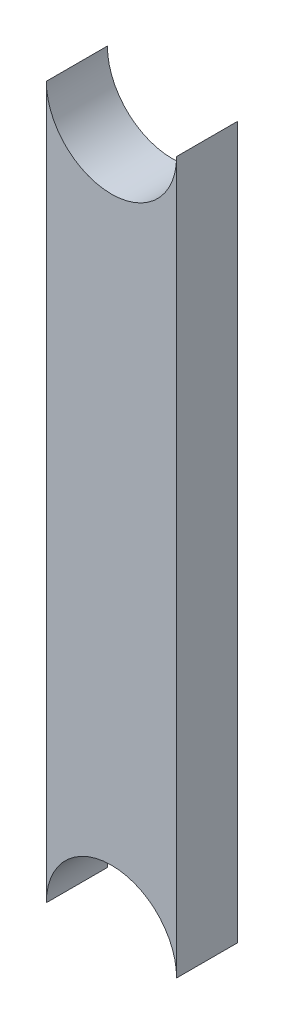
from build123d import *

# Parameters (mm, degrees)
BOSS_EXTRUDE3_DEPTH = 3


with BuildPart() as part:
    # Sketch1 → Boss-Extrude3 (new body)
    with BuildSketch(Plane.XY):
        with BuildLine():
            Line((-3.2, 0), (-3.2, 34.9448))
            ThreePointArc((-3.2, 34.9448), (0, 31.7448), (3.2, 34.9448))
            Line((3.2, 34.9448), (3.2, 0))
            ThreePointArc((3.2, 0), (0, 3.2), (-3.2, 0))
        make_face()
    extrude(amount=BOSS_EXTRUDE3_DEPTH)


solid = part.part
